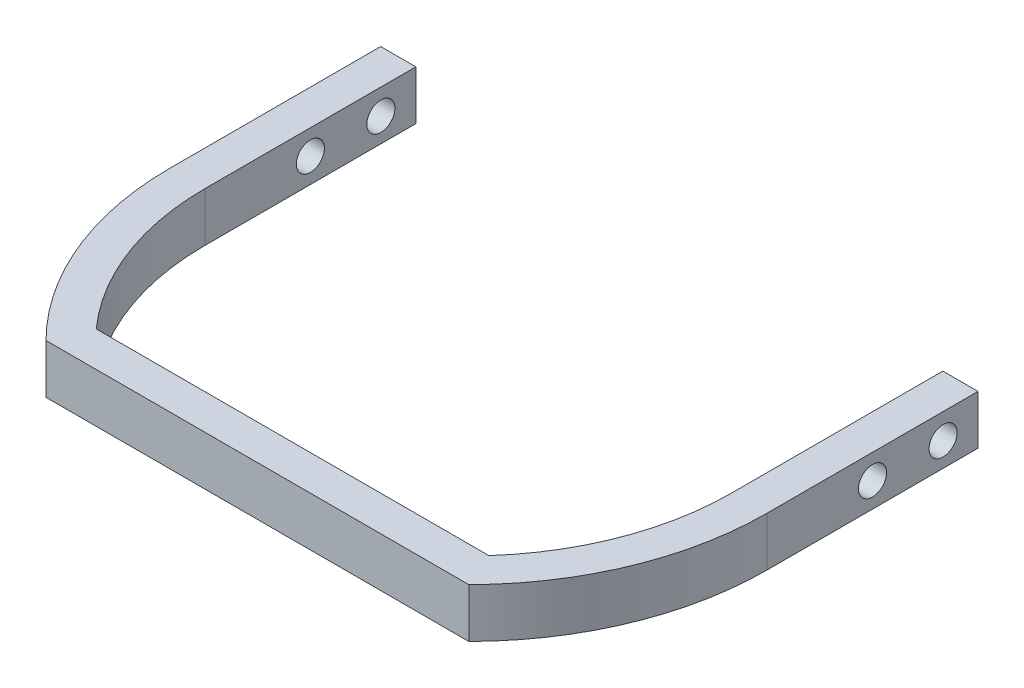
from build123d import *

# Parameters (mm, degrees)
SKETCH_1_W          = 5
SKETCH_1_H          = 30
EXTRUDE_1_DEPTH     = 7
EXTRUDE_1_2_DEPTH   = 7
SKETCH_2_R          = 2
CUT_EXTRUDE_1_DEPTH = 91.353769152
EXTRUDE_2_DEPTH     = 7


with BuildPart() as part:
    # Эскиз1 → Бобышка-Вытянуть1 (new body)
    with BuildSketch(Plane(origin=(0, 0, 0), x_dir=(1, 0, 0), z_dir=(0, 1, 0))):
        with Locations((-39.97, 15)):
            Rectangle(SKETCH_1_W, SKETCH_1_H)
    extrude(amount=EXTRUDE_1_DEPTH)


with BuildPart() as body_2:
    # Эскиз1 → Extrude 1 2 (new body)
    with BuildSketch(Plane(origin=(0, 0, 0), x_dir=(1, 0, 0), z_dir=(0, 1, 0))):
        with Locations((39.97, 15)):
            Rectangle(SKETCH_1_W, SKETCH_1_H)
    extrude(amount=EXTRUDE_1_2_DEPTH)


with BuildPart() as cut_extrude_1_tool:
    # Эскиз2 → Вырез-Вытянуть1 (new, through all)
    with BuildSketch(Plane.ZY.offset(42.47)):
        with Locations((-15, 3.5)):
            Circle(SKETCH_2_R)
        with Locations((-25.033065305, 3.407092775)):
            Circle(SKETCH_2_R)
    extrude(amount=-CUT_EXTRUDE_1_DEPTH)


with BuildPart() as part_1:
    add(part.part)

    # Вырез-Вытянуть1: cut by cut_extrude_1_tool
    add(cut_extrude_1_tool.part, mode=Mode.SUBTRACT)



with BuildPart() as body_2_1:
    add(body_2.part)

    # Вырез-Вытянуть1: cut by cut_extrude_1_tool
    add(cut_extrude_1_tool.part, mode=Mode.SUBTRACT)


with BuildPart() as part_2:
    add(part_1.part)

    add(body_2_1.part)  # Бобышка-Вытянуть2 merges body 2
    # Эскиз3 → Бобышка-Вытянуть2 (add)
    with BuildSketch(Plane(origin=(0, 7, 0), x_dir=(1, 0, 0), z_dir=(0, 1, 0))):
        with BuildLine():
            ThreePointArc((22.449964365, -30), (25.304076717, -27.635205835), (27.910587597, -25))
            Line((27.910587597, -25), (-27.910587597, -25))
            ThreePointArc((-27.910587597, -25), (-25.304076717, -27.635205835), (-22.449964365, -30))
            Line((-22.449964365, -30), (22.449964365, -30))
        make_face()
        with BuildLine():
            ThreePointArc((-22.449964365, -30), (-25.304076717, -27.635205835), (-27.910587597, -25))
            ThreePointArc((-27.910587597, -25), (-34.99864724, -13.382660101), (-37.47, 0))
            Line((-37.47, 0), (-42.47, 0))
            ThreePointArc((-42.47, 0), (-39.245495492, -16.232436156), (-30.061618386, -30))
            Line((-30.061618386, -30), (-22.449964365, -30))
        make_face()
        with BuildLine():
            ThreePointArc((37.47, 0), (34.99864724, -13.382660101), (27.910587597, -25))
            ThreePointArc((27.910587597, -25), (25.304076717, -27.635205835), (22.449964365, -30))
            Line((22.449964365, -30), (30.061618386, -30))
            ThreePointArc((30.061618386, -30), (39.245495492, -16.232436156), (42.47, 0))
            Line((42.47, 0), (37.47, 0))
        make_face()
    extrude(amount=-EXTRUDE_2_DEPTH)


solid = part_2.part
